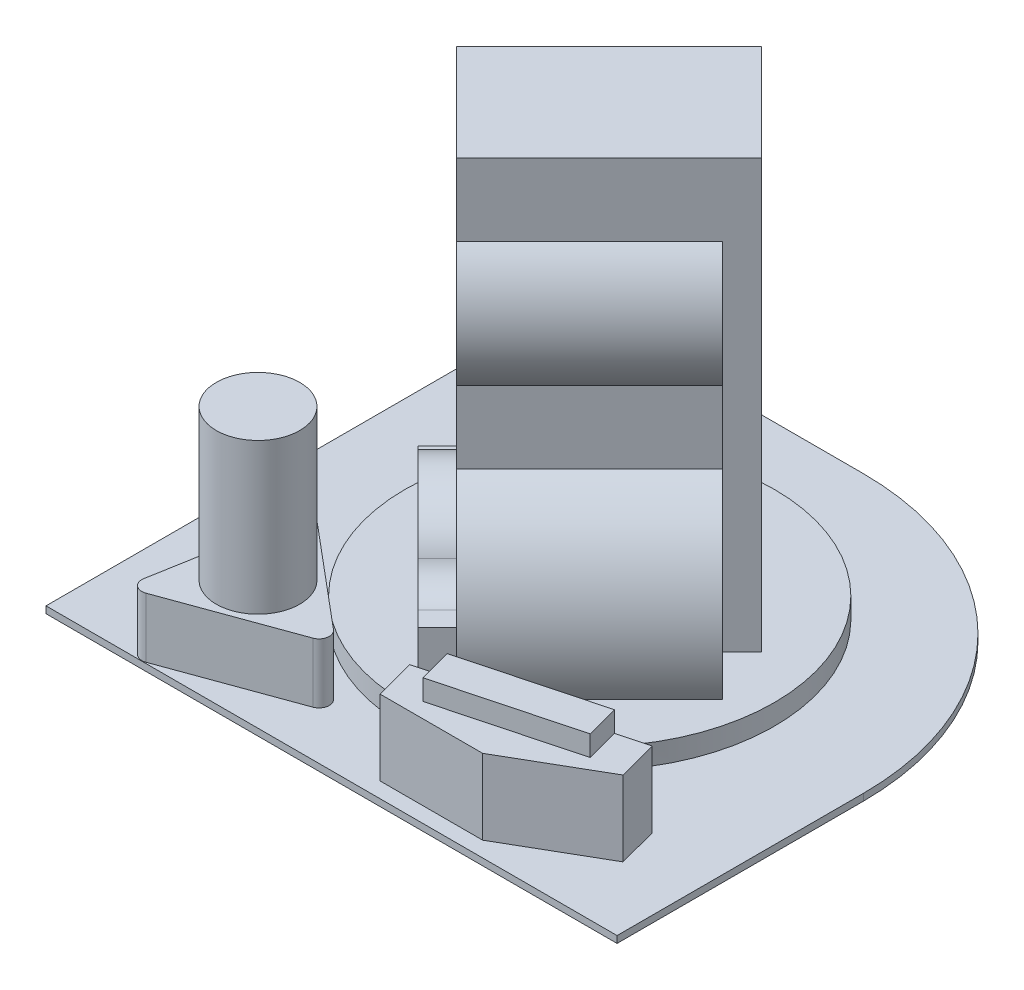
from build123d import *

# Parameters (mm, degrees)
BOSS_EXTRUDE1_DEPTH  = 2
SKETCH3_R            = 54
CUT_EXTRUDE1_DEPTH   = 2
SKETCH4_R            = 40
TIRE_DEPTH           = 27.5
STEER_GEAR_DEPTH     = 17.5
SKETCH6_R            = 12.2
EXTRUDE_M_DEPTH      = 44
SENSOR_GEAR_DEPTH    = 22
ENC_DEPTH            = 6
BOSS_EXTRUDE7_START  = 8
SKETCH10_R           = 54
BOSS_EXTRUDE7_DEPTH  = 8
SKETCH11_R           = 27.5
BOSS_EXTRUDE8_DEPTH  = 27.5
BOSS_EXTRUDE9_START  = 27.5
SKETCH12_W           = 125
SKETCH12_H           = 40
BOSS_EXTRUDE9_DEPTH  = 8
BOSS_EXTRUDE10_DEPTH = 8
BOSS_EXTRUDE11_DEPTH = 55


with BuildPart() as part:
    # Sketch2 → Boss-Extrude1 (new body)
    with BuildSketch(Plane(origin=(0, 0, 0), x_dir=(1, 0, 0), z_dir=(0, 1, 0))):
        with BuildLine():
            Line((-83.5, -76.5), (83.5, -76.5))
            Line((83.5, -76.5), (83.5, -4.5))
            ThreePointArc((83.5, -4.5), (59.775649276, 52.775649276), (2.5, 76.5))
            Line((2.5, 76.5), (-83.5, 76.5))
            Line((-83.5, 76.5), (-83.5, -76.5))
        make_face()
    extrude(amount=BOSS_EXTRUDE1_DEPTH)

    # Sketch3 → Cut-Extrude1 (cut)
    with BuildSketch(Plane(origin=(0, 2, 0), x_dir=(1, 0, 0), z_dir=(0, 1, 0))):
        with Locations(Location((-0.5, -0.5, 0), (0, 0, 270))):
            Circle(SKETCH3_R)
    extrude(amount=-CUT_EXTRUDE1_DEPTH, mode=Mode.SUBTRACT)

    # Sketch5 → steer_gear (add)
    with BuildSketch(Plane(origin=(0, 2, 0), x_dir=(1, 0, 0), z_dir=(0, 1, 0))):
        with BuildLine():
            Line((-17.905866605, -58.022126579), (-47.096080324, -33.528629013))
            ThreePointArc((-47.096080324, -33.528629013), (-50.050503583, -33.00768448), (-51.978866412, -35.30581781))
            Line((-51.978866412, -35.30581781), (-58.595750672, -72.832033216))
            ThreePointArc((-58.595750672, -72.832033216), (-57.569690242, -75.651111078), (-54.615266983, -76.172055611))
            Line((-54.615266983, -76.172055611), (-18.808169004, -63.139337771))
            ThreePointArc((-18.808169004, -63.139337771), (-16.879806175, -60.841204442), (-17.905866605, -58.022126579))
        make_face()
    extrude(amount=STEER_GEAR_DEPTH)

    # Sketch6 → Extrude m (add)
    with BuildSketch(Plane(origin=(0, 19.5, 0), x_dir=(1, 0, 0), z_dir=(0, 1, 0))):
        with Locations(Location((-41.5, -56.5, 0), (0, 0, 270))):
            Circle(SKETCH6_R)
    extrude(amount=EXTRUDE_M_DEPTH)

    # Sketch7 → sensor_gear (add)
    with BuildSketch(Plane(origin=(0, 2, 0), x_dir=(1, 0, 0), z_dir=(0, 1, 0))):
        Polygon((6.576565556, -60.227063703), (9.69482899, -72), (39.69482899, -72), (65.715690522, -56.97684859), (62.643232223, -45.37684859), align=None)
    extrude(amount=SENSOR_GEAR_DEPTH)

    # Sketch8 → enc (add)
    with BuildSketch(Plane(origin=(0, 24, 0), x_dir=(1, 0, 0), z_dir=(0, 1, 0))):
        Polygon((15.276565556, -57.922719978), (17.836947472, -67.589386645), (56.503614139, -57.347858981), (53.943232223, -47.681192314), align=None)
    extrude(amount=ENC_DEPTH)



with BuildPart() as body_2:
    # Sketch4 → tire (new, symmetric)
    with BuildSketch(Plane(origin=(-0.853553391, 0, 0.146446609), x_dir=(-0.7071067811865488, 0, -0.7071067811865464), z_dir=(0.7071067811865464, 0, -0.7071067811865488))):
        with Locations((-0.5, 23)):
            Circle(SKETCH4_R)
    extrude(amount=TIRE_DEPTH, both=True)


with BuildPart() as part_1:
    add(part.part)

    add(body_2.part)  # Boss-Extrude7 merges body 2
    # Sketch10 → Boss-Extrude7 (add)
    with BuildSketch(Plane(origin=(0, 0, 0), x_dir=(1, 0, 0), z_dir=(0, 1, 0)).offset(BOSS_EXTRUDE7_START)):
        with Locations(Location((-0.5, -0.5, 0), (0, 0, 90))):
            Circle(SKETCH10_R)
    extrude(amount=-BOSS_EXTRUDE7_DEPTH)

    # Sketch11 → Boss-Extrude8 (add, symmetric)
    with BuildSketch(Plane(origin=(-0.5, 0, 0.5), x_dir=(0, 1, 0), z_dir=(0.7071067811865464, 0, -0.7071067811865488))):
        with Locations((93, 0)):
            Circle(SKETCH11_R)
        with BuildLine():
            Line((77.226648, 22.526681218), (56.053723441, 22.526681218))
            ThreePointArc((56.053723441, 22.526681218), (63, 0), (56.053723441, -22.526681218))
            Line((56.053723441, -22.526681218), (77.226648, -22.526681218))
            ThreePointArc((77.226648, -22.526681218), (65.5, 0), (77.226648, 22.526681218))
        make_face()
    extrude(amount=BOSS_EXTRUDE8_DEPTH, both=True)

    # Sketch12 → Boss-Extrude9 (add)
    with BuildSketch(Plane(origin=(-0.5, 0, 0.5), x_dir=(0, 1, 0), z_dir=(0.7071067811865464, 0, -0.7071067811865488)).offset(BOSS_EXTRUDE9_START)):
        with Locations((70.5, 0)):
            Rectangle(SKETCH12_W, SKETCH12_H)
    extrude(amount=BOSS_EXTRUDE9_DEPTH)

    # Sketch14 → Boss-Extrude10 (add)
    with BuildSketch(Plane(origin=(-19.945436483, 0, 19.945436483), x_dir=(0.7071067811865487, 0, 0.7071067811865465), z_dir=(-0.7071067811865465, 0, 0.7071067811865487))):
        with BuildLine():
            Line((-32.5, 8), (32.5, 8))
            Line((32.5, 8), (32.5, 23))
            Line((32.5, 23), (26.153393661, 23))
            ThreePointArc((26.153393661, 23), (20.483926566, 24.76245529), (16.812895925, 29.428571429))
            ThreePointArc((16.812895925, 29.428571429), (0, 41), (-16.812895925, 29.428571429))
            ThreePointArc((-16.812895925, 29.428571429), (-20.483926566, 24.76245529), (-26.153393661, 23))
            Line((-26.153393661, 23), (-32.5, 23))
            Line((-32.5, 23), (-32.5, 8))
        make_face()
    extrude(amount=BOSS_EXTRUDE10_DEPTH)

    # Sketch15 → Boss-Extrude11 (add)
    with BuildSketch(Plane(origin=(18.945436483, 0, -18.945436483), x_dir=(0.7071067811865487, 0, 0.7071067811865465), z_dir=(-0.7071067811865465, 0, 0.7071067811865487))):
        with BuildLine():
            Line((-20, 133), (-20, 111.874586088))
            ThreePointArc((-20, 111.874586088), (0, 120.5), (20, 111.874586088))
            Line((20, 111.874586088), (20, 133))
            Line((20, 133), (-20, 133))
        make_face()
    extrude(amount=BOSS_EXTRUDE11_DEPTH)


solid = part_1.part
